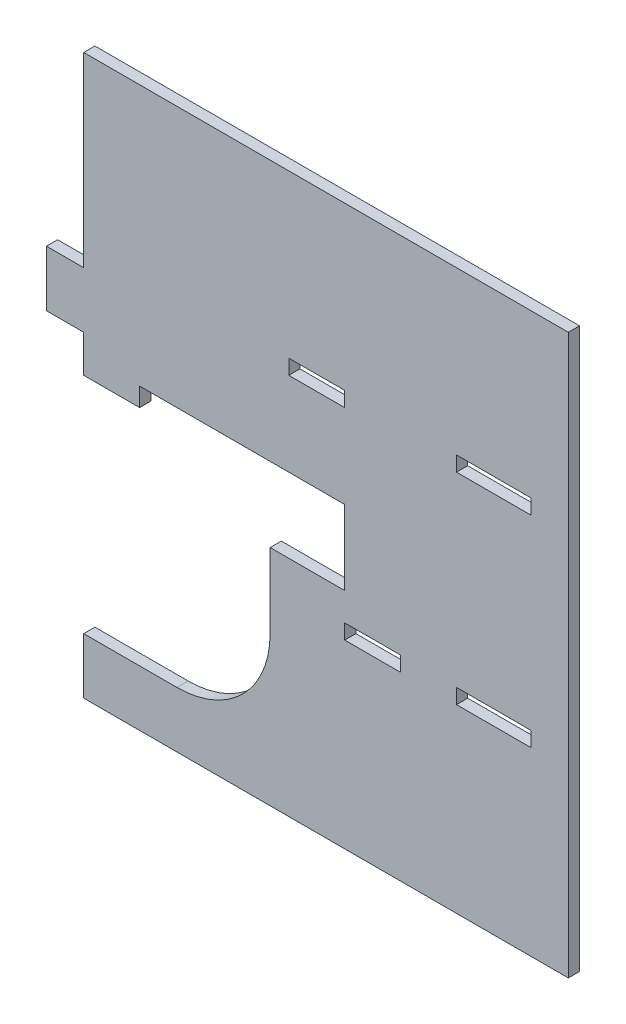
from build123d import *

# Parameters (mm, degrees)
BOSS_EXTRUDE1_DEPTH = 0.15
FILLET4_R           = 2.5
SKETCH3_W           = 2
SKETCH3_H           = 0.4
SKETCH3_W_2         = 1.5
CUT_EXTRUDE1_DEPTH  = 19.603494295


with BuildPart() as part:
    # Sketch1 → Boss-Extrude1 (new, symmetric)
    with BuildSketch(Plane.XY):
        Polygon((0, 0), (-10, 0), (-10, 1.5), (-5, 1.5), (-5, 6), (-3, 6), (-3, 8), (-8.5, 8), (-8.5, 7.5), (-10, 7.5), (-10, 8.5), (-11, 8.5), (-11, 10), (-10, 10), (-10, 15), (0, 15), (3, 15), (3, 0), align=None)
    extrude(amount=BOSS_EXTRUDE1_DEPTH, both=True)

    # Fillet4
    fillet4_edges = [part.edges().sort_by_distance(p)[0] for p in [
        (-5, 1.5, 0),
    ]]
    fillet(fillet4_edges, radius=FILLET4_R)

    # Sketch3 → Cut-Extrude1 (cut, through all)
    with BuildSketch(Plane.XY.offset(0.15)):
        with Locations((1, 5.05)):
            Rectangle(SKETCH3_W, SKETCH3_H)
        with Locations((-2.25, 5.05)):
            Rectangle(SKETCH3_W_2, SKETCH3_H)
        with Locations((1, 10.45)):
            Rectangle(SKETCH3_W, SKETCH3_H)
        with Locations((-3.75, 10.45)):
            Rectangle(SKETCH3_W_2, SKETCH3_H)
    extrude(amount=-CUT_EXTRUDE1_DEPTH, mode=Mode.SUBTRACT)


solid = part.part
